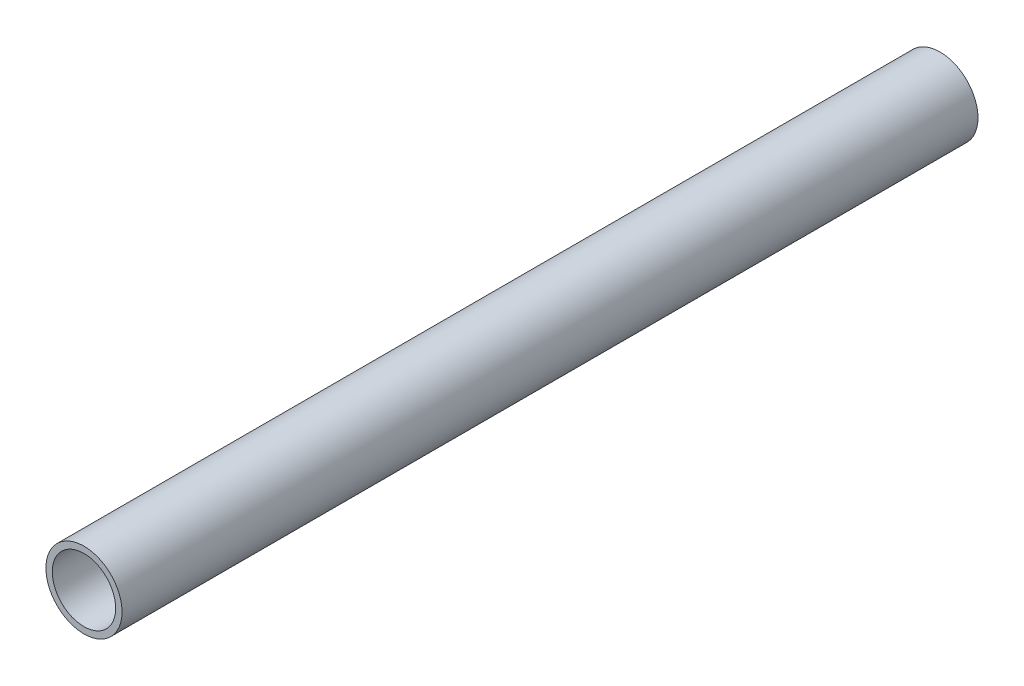
from build123d import *

# Parameters (mm, degrees)
SKETCH1_R           = 6
SKETCH1_R_2         = 5
EXTRUDE_THIN1_DEPTH = 135


with BuildPart() as part:
    # Sketch1 → Extrude-Thin1 (new body)
    with BuildSketch(Plane.XY):
        Circle(SKETCH1_R)
        Circle(SKETCH1_R_2, mode=Mode.SUBTRACT)
    extrude(amount=EXTRUDE_THIN1_DEPTH)


solid = part.part
